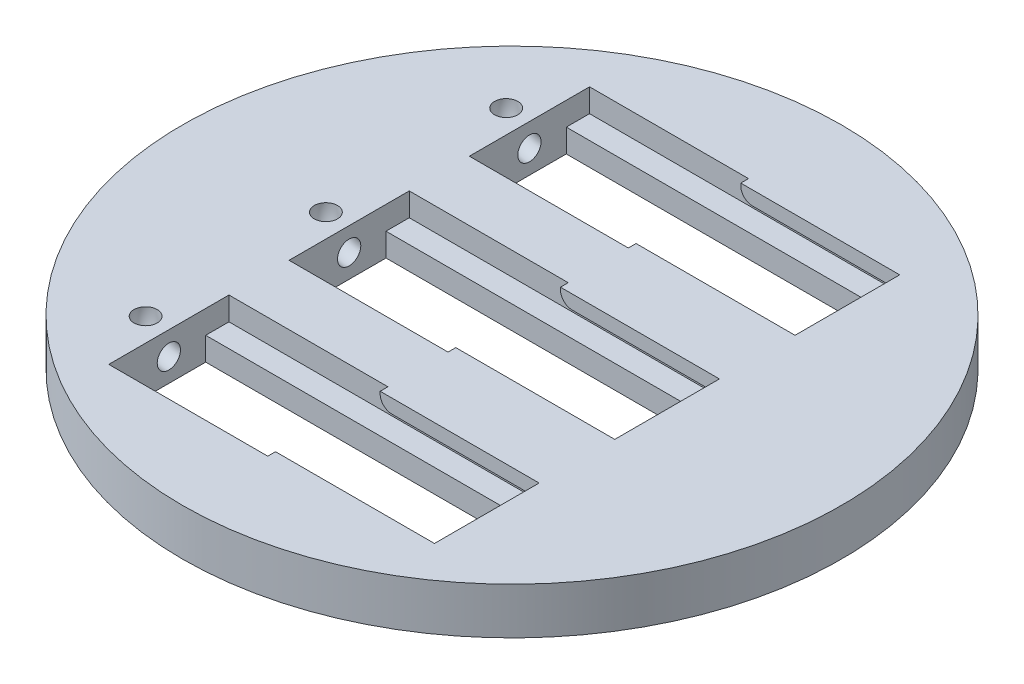
from build123d import *

# Parameters (mm, degrees)
SKETCH1_R              = 42.5
BOSS_EXTRUDE1_DEPTH    = 6
SKETCH2_W              = 20.5
SKETCH2_H              = 15.5
CUT_EXTRUDE1_DEPTH     = 3
CUT_EXTRUDE2_DEPTH     = 20.5
CUT_EXTRUDE3_REACH     = 86.892
SKETCH4_W              = 41
SKETCH4_H              = 9.5
SKETCH5_R              = 1.5
FILLET1_R              = 1.5
LPATTERN4_COUNT        = 3
LPATTERN4_PITCH        = 23.25
FILLET1_OF_LPATTERN4_R = 1.5


with BuildPart() as part:
    # Sketch1 → Boss-Extrude1 (new body)
    with BuildSketch(Plane(origin=(0, 0, 0), x_dir=(1, 0, 0), z_dir=(0, 1, 0))):
        with Locations(Location((-26.111816808, -7.400353612, 0), (0, 0, 270))):
            Circle(SKETCH1_R)
    extrude(amount=BOSS_EXTRUDE1_DEPTH)

    # Sketch2 → Cut-Extrude1 (cut)
    with BuildSketch(Plane(origin=(0, 6, 0), x_dir=(1, 0, 0), z_dir=(0, 1, 0))):
        with Locations((-36.361816808, 15.349646388)):
            Rectangle(SKETCH2_W, SKETCH2_H)
    cut_extrude1 = extrude(amount=-CUT_EXTRUDE1_DEPTH, mode=Mode.SUBTRACT)

    # Sketch3 → Cut-Extrude2 (cut)
    with BuildSketch(Plane.ZY.offset(26.111816808)):
        Polygon((-23.099646388, 3), (-7.599646388, 3), (-7.599646388, 4.2), (-8.599646388, 4.2), (-8.599646388, 6), (-22.099646388, 6), (-22.099646388, 4.2), (-23.099646388, 4.2), align=None)
    cut_extrude2 = extrude(amount=-CUT_EXTRUDE2_DEPTH, mode=Mode.SUBTRACT)

    # Sketch4 → Cut-Extrude3 (cut, up to next)
    with BuildSketch(Plane(origin=(0, 3, 0), x_dir=(1, 0, 0), z_dir=(0, 1, 0)), mode=Mode.PRIVATE) as cut_extrude3_sk1:
        with Locations((-26.111816808, 15.349646388)):
            Rectangle(SKETCH4_W, SKETCH4_H)
    cut_extrude3_tool1 = extrude(cut_extrude3_sk1.sketch, amount=-CUT_EXTRUDE3_REACH, mode=Mode.PRIVATE) & part.part
    cut_extrude3 = cut_extrude3_tool1.solids().sort_by_distance((-26.111817, 3, -15.349646))[0]
    add(cut_extrude3, mode=Mode.SUBTRACT)

    # Sketch5 → Cut-Revolve1 (revolve, cut)
    with BuildSketch(Plane(origin=(-46.611816808, 0, 0), x_dir=(0, 0, -1), z_dir=(1, 0, 0)), mode=Mode.PRIVATE) as cut_revolve1_sk:
        with Locations((15.348547186, 3)):
            Circle(SKETCH5_R)
    cut_revolve1 = revolve(cut_revolve1_sk.sketch.rotate(Axis((-46.611816808, 6, -23.099646388), (0, 0, 1)), 315), axis=Axis((-46.611816808, 6, -23.099646388), (0, 0, 1)), mode=Mode.SUBTRACT)

    # Fillet1
    fillet1_edges = [part.edges().sort_by_distance(p)[0] for p in [
        (-26.111816808, 4.2, -8.099646388),
        (-26.111816808, 4.2, -22.599646388),
    ]]
    fillet(fillet1_edges, radius=FILLET1_R)

    # LPattern4: Cut-Extrude1, Cut-Extrude2, Cut-Extrude3, Cut-Revolve1 ×3
    with Locations(*[(0, 0, i * LPATTERN4_PITCH) for i in range(1, LPATTERN4_COUNT)]):
        add(cut_extrude1, mode=Mode.SUBTRACT)
        add(cut_extrude2, mode=Mode.SUBTRACT)
        add(cut_extrude3, mode=Mode.SUBTRACT)
        add(cut_revolve1, mode=Mode.SUBTRACT)

    # Fillet1 of LPattern4
    fillet1_of_lpattern4_edges = [part.edges().sort_by_distance(p)[0] for p in [
        (-26.111816808, 4.2, 15.150353612),
        (-26.111816808, 4.2, 0.650353612),
        (-26.111816808, 4.2, 38.400353612),
        (-26.111816808, 4.2, 23.900353612),
    ]]
    fillet(fillet1_of_lpattern4_edges, radius=FILLET1_OF_LPATTERN4_R)


solid = part.part
